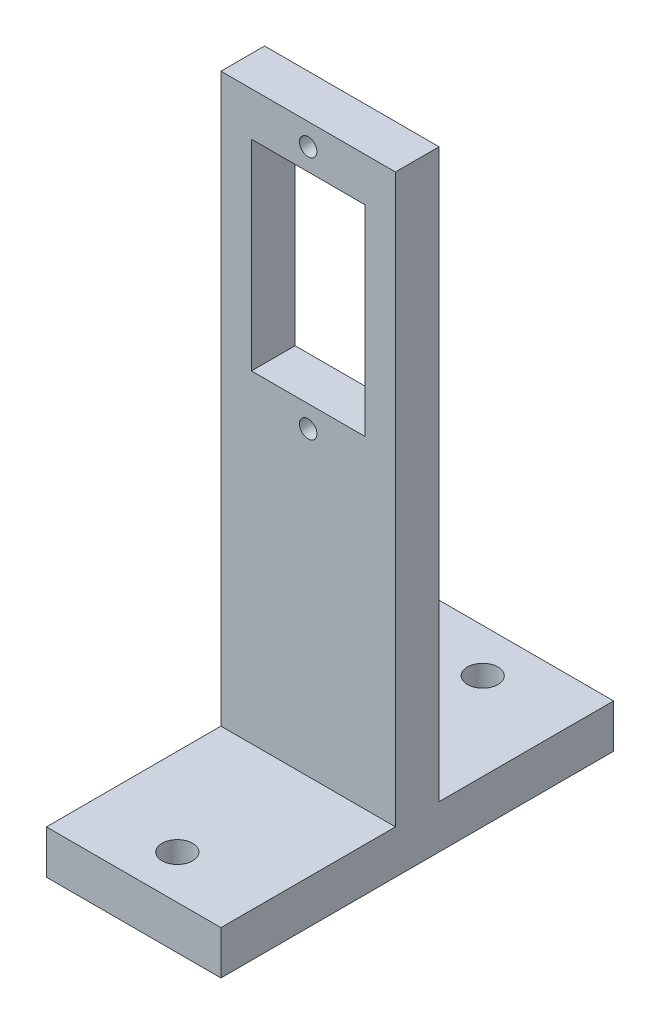
from build123d import *

# Parameters (mm, degrees)
IZIM1_W                          = 20
IZIM1_H                          = 5
Y_KSEKLIK_EKSTR_ZYON3_DEPTH      = 70
IZIM2_R                          = 1
IZIM2_W                          = 13
IZIM2_H                          = 23
KES_EKSTR_ZYON1_DEPTH            = 70
Y_KSEKLIK_EKSTR_ZYON4_DEPTH      = 20
Y_KSEKLIK_EKSTR_ZYON4_DEPTH_BACK = 25
IZIM3_W                          = 20
IZIM3_H                          = 5
IZIM4_R                          = 1.75
KES_EKSTR_ZYON2_DEPTH            = 25


with BuildPart() as part:
    # Çizim1 → Yükseklik-Ekstrüzyon3 (new body)
    with BuildSketch(Plane(origin=(0, 0, 0), x_dir=(1, 0, 0), z_dir=(0, 1, 0))):
        with Locations((10, 2.5)):
            Rectangle(IZIM1_W, IZIM1_H)
    extrude(amount=Y_KSEKLIK_EKSTR_ZYON3_DEPTH)

    # Çizim2 → Kes-Ekstrüzyon1 (cut)
    with BuildSketch(Plane.XY):
        with Locations((10, 67.5)):
            Circle(IZIM2_R)
        with Locations((10, 39.5)):
            Circle(IZIM2_R)
        with Locations((10, 53.5)):
            Rectangle(IZIM2_W, IZIM2_H)
    extrude(amount=-KES_EKSTR_ZYON1_DEPTH, mode=Mode.SUBTRACT)

    # Çizim3 → Yükseklik-Ekstrüzyon4 (add, two sides: drawn at the far end of the back side and taken through both)
    with BuildSketch(Plane.XY.offset(-Y_KSEKLIK_EKSTR_ZYON4_DEPTH_BACK)):
        with Locations((10, 2.5)):
            Rectangle(IZIM3_W, IZIM3_H)
    extrude(amount=Y_KSEKLIK_EKSTR_ZYON4_DEPTH + Y_KSEKLIK_EKSTR_ZYON4_DEPTH_BACK)

    # Çizim4 → Kes-Ekstrüzyon2 (cut)
    with BuildSketch(Plane(origin=(0, 5, 0), x_dir=(1, 0, 0), z_dir=(0, 1, 0))):
        with Locations(Location((10, -15, 0), (0, 0, 270))):
            Circle(IZIM4_R)
        with Locations(Location((10, 20, 0), (0, 0, 270))):
            Circle(IZIM4_R)
    extrude(amount=-KES_EKSTR_ZYON2_DEPTH, mode=Mode.SUBTRACT)


solid = part.part
